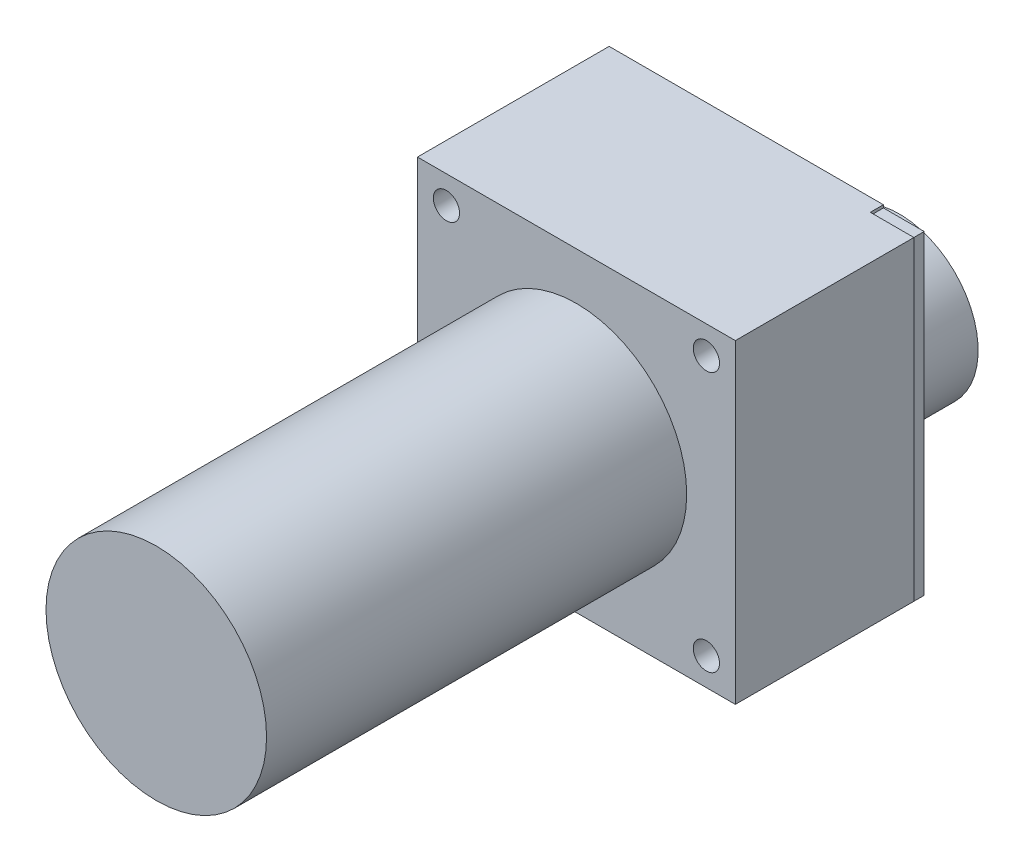
from build123d import *

# Parameters (mm, degrees)
BOSS_EXTRUDE1_DEPTH = 2.5
SKETCH3_W           = 45
SKETCH3_H           = 1.418134712
SKETCH3_W_2         = 44.463900584
SKETCH3_H_2         = 3.684459624
BOSS_EXTRUDE2_DEPTH = 31.5
SKETCH4_W           = 60.536099416
SKETCH4_H           = 60
BOSS_EXTRUDE3_DEPTH = 34
SKETCH5_R           = 21
BOSS_EXTRUDE4_DEPTH = 80
SKETCH6_R           = 4
BOSS_EXTRUDE5_DEPTH = 3
SKETCH7_R           = 15
BOSS_EXTRUDE6_DEPTH = 22
SKETCH13_R          = 2
CUT_EXTRUDE1_DEPTH  = 3
CUT_EXTRUDE2_START  = -3
SKETCH14_R          = 2
CUT_EXTRUDE2_DEPTH  = 3
SKETCH15_R          = 2.5
SKETCH15_W          = 52.231950292
SKETCH15_H          = 11.081865288
SKETCH15_W_2        = 52.768049708
SKETCH15_H_2        = 8.918134712
CUT_EXTRUDE3_DEPTH  = 128.185394164


with BuildPart() as part:
    # Sketch2 → Boss-Extrude1 (new body)
    with BuildSketch(Plane.XY):
        Polygon((-30.268049708, -30), (-30.268049708, 31.081865288), (-22.5, 31.081865288), (-22.5, 41.081865288), (21.963900584, 41.081865288), (21.963900584, 29.468648207), (29.731950292, 29.468648207), (29.731950292, -30.531351793), (22.5, -30.531351793), (22.5, -38.918134712), (-22.5, -38.918134712), (-22.5, -30), align=None)
    extrude(amount=BOSS_EXTRUDE1_DEPTH)

    # Sketch3 → Boss-Extrude2 (add)
    with BuildSketch(Plane.XY.offset(2.5)):
        with Locations((0, -38.209067356)):
            Rectangle(SKETCH3_W, SKETCH3_H)
        with Locations((-0.268049708, 39.239635476)):
            Rectangle(SKETCH3_W_2, SKETCH3_H_2)
    extrude(amount=BOSS_EXTRUDE2_DEPTH)

    # Sketch4 → Boss-Extrude3 (add)
    with BuildSketch(Plane.XY.offset(2.5)):
        Rectangle(SKETCH4_W, SKETCH4_H)
    extrude(amount=BOSS_EXTRUDE3_DEPTH)

    # Sketch5 → Boss-Extrude4 (add)
    with BuildSketch(Plane.XY.offset(36.5)):
        Circle(SKETCH5_R)
    extrude(amount=BOSS_EXTRUDE4_DEPTH)

    # Sketch6 → Boss-Extrude5 (add)
    with BuildSketch(Plane(origin=(0, 0, 0), x_dir=(-1, 0, 0), z_dir=(0, 0, -1))):
        with Locations((0, -10)):
            Circle(SKETCH6_R)
    extrude(amount=BOSS_EXTRUDE5_DEPTH)

    # Sketch7 → Boss-Extrude6 (add)
    with BuildSketch(Plane(origin=(0, 0, -3), x_dir=(-1, 0, 0), z_dir=(0, 0, -1))):
        with Locations((0, -10)):
            Circle(SKETCH7_R)
    extrude(amount=BOSS_EXTRUDE6_DEPTH)

    # Sketch13 → Cut-Extrude1 (cut)
    with BuildSketch(Plane(origin=(0, 41.081865288, 0), x_dir=(1, 0, 0), z_dir=(0, 1, 0))):
        with Locations(Location((-12.5, -14, 0), (0, 0, 270))):
            Circle(SKETCH13_R)
        with Locations(Location((12.5, -14, 0), (0, 0, 270))):
            Circle(SKETCH13_R)
        with Locations(Location((-12.5, -26, 0), (0, 0, 270))):
            Circle(SKETCH13_R)
        with Locations(Location((12.5, -26, 0), (0, 0, 270))):
            Circle(SKETCH13_R)
    extrude(amount=-CUT_EXTRUDE1_DEPTH, mode=Mode.SUBTRACT)

    # Sketch14 → Cut-Extrude2 (cut)
    with BuildSketch(Plane.XZ.offset(38.918134712).offset(CUT_EXTRUDE2_START)):
        with Locations(Location((12.5, 26, 0), (0, 0, 90))):
            Circle(SKETCH14_R)
        with Locations(Location((12.5, 14, 0), (0, 0, 90))):
            Circle(SKETCH14_R)
        with Locations(Location((-12.5, 14, 0), (0, 0, 90))):
            Circle(SKETCH14_R)
        with Locations(Location((-12.5, 26, 0), (0, 0, 90))):
            Circle(SKETCH14_R)
    extrude(amount=CUT_EXTRUDE2_DEPTH, mode=Mode.SUBTRACT)

    # Sketch15 → Cut-Extrude3 (cut, through all)
    with BuildSketch(Plane(origin=(0, 0, 0), x_dir=(-1, 0, 0), z_dir=(0, 0, -1))):
        with Locations((-24.75, 24.75)):
            Circle(SKETCH15_R)
        with Locations((24.75, 24.75)):
            Circle(SKETCH15_R)
        with Locations((24.75, -24.75)):
            Circle(SKETCH15_R)
        with Locations((-24.75, -24.75)):
            Circle(SKETCH15_R)
        with Locations((4.152074562, 35.540932644)):
            Rectangle(SKETCH15_W, SKETCH15_H)
        with Locations((3.884024854, -34.459067356)):
            Rectangle(SKETCH15_W_2, SKETCH15_H_2)
    extrude(amount=-CUT_EXTRUDE3_DEPTH, mode=Mode.SUBTRACT)


solid = part.part
